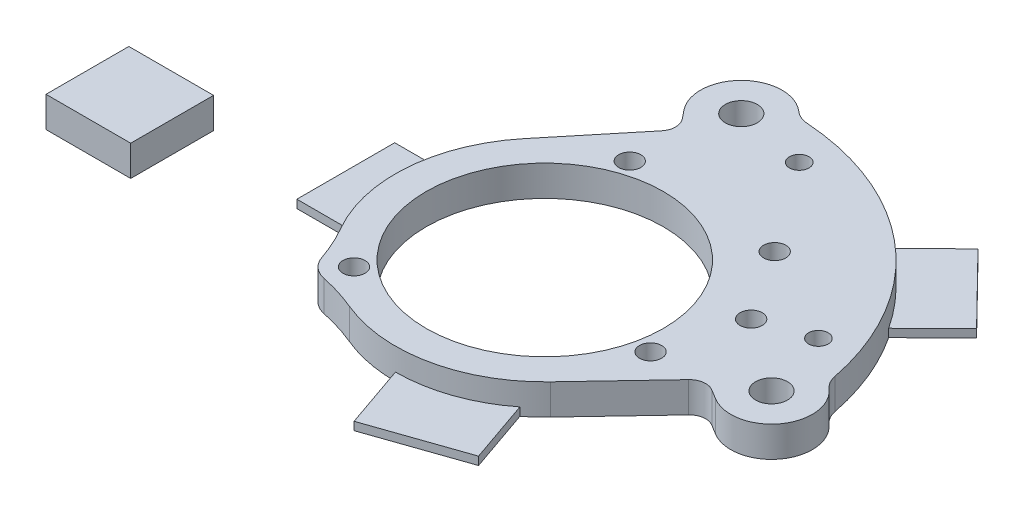
from build123d import *

# Parameters (mm, degrees)
SKETCH1_R                 = 0.127
SKETCH1_R_2               = 18.480949957
BOSS_EXTRUDE1_DEPTH       = 4.7625
FILLET1_R                 = 2.54
F_10_CLEARANCE_HOLE1_D    = 4.9784
CUT_EXTRUDE1_REACH        = 60.938
SKETCH4_R                 = 1.524
F_8_32_TAPPED_HOLE1_D     = 3.4544
F_8_32_TAPPED_HOLE1_DEPTH = 10.7188
F_8_32_TAPPED_HOLE1_TIP   = 1.037806461
BOSS_EXTRUDE2_START       = -4.7625
BOSS_EXTRUDE2_DEPTH       = 4.7625
FILLET2_R                 = 31.75
SKETCH7_W                 = 13.194755421
SKETCH7_H                 = 12.906169147
BOSS_EXTRUDE3_DEPTH       = 4.7625
SKETCH8_W                 = 9.01972476
SKETCH8_H                 = 15.24
BOSS_EXTRUDE4_DEPTH       = 1.27


with BuildPart() as part:
    # Sketch1 → Boss-Extrude1 (new body)
    with BuildSketch(Plane(origin=(0, 0, 0), x_dir=(1, 0, 0), z_dir=(0, 1, 0))):
        with BuildLine():
            Line((32.022269256, -5.421481005), (28.769380653, -3.437844007))
            Line((28.769380653, -3.437844007), (16.899441567, -15.986018234))
            ThreePointArc((16.899441567, -15.986018234), (-15.382244428, -17.450801146), (-17.980601649, 14.759467084))
            Line((-17.980601649, 14.759467084), (-7.021401387, 28.11042435))
            Line((-7.021401387, 28.11042435), (-9.397611693, 31.088632634))
            ThreePointArc((-9.397611693, 31.088632634), (-8.812620694, 39.64785023), (-0.235016559, 39.812554878))
            ThreePointArc((-0.235016559, 39.812554878), (0.816557871, 39.154771525), (2.023694251, 38.869623355))
            ThreePointArc((2.023694251, 38.869623355), (25.590169938, 29.031456949), (38.308287357, 6.886078562))
            ThreePointArc((38.308287357, 6.886078562), (38.742684134, 5.724275154), (39.527245579, 4.763571735))
            ThreePointArc((39.527245579, 4.763571735), (40.440387397, -3.766879153), (32.022269256, -5.421481005))
        make_face()
        with Locations(Location((16.782521583, 19.039383247, 0), (0, 0, 270))):
            Circle(SKETCH1_R, mode=Mode.SUBTRACT)
        with Locations(Location((24.05378148, 8.097328768, 0), (0, 0, 270))):
            Circle(SKETCH1_R, mode=Mode.SUBTRACT)
        with Locations(Location((0, 0, 0), (0, 0, 90))):
            Circle(SKETCH1_R_2, mode=Mode.SUBTRACT)
    extrude(amount=BOSS_EXTRUDE1_DEPTH)

    # Fillet1
    fillet1_edges = [part.edges().sort_by_distance(p)[0] for p in [
        (-7.021401387, 2.38125, -28.11042435),
        (28.769380653, 2.38125, 3.437844007),
    ]]
    fillet(fillet1_edges, radius=FILLET1_R)

    # #10 Clearance Hole1 (through all)
    with Locations(Plane(origin=(0, 4.7625, 0), x_dir=(1, 0, 0), z_dir=(0, 1, 0))):
        with Locations((-4.433931219, 35.048983143), (35.328330918, 0)):
            Hole(F_10_CLEARANCE_HOLE1_D / 2)

    # Sketch4 → Cut-Extrude1 (cut, up to next)
    with BuildSketch(Plane(origin=(0, 4.7625, 0), x_dir=(1, 0, 0), z_dir=(0, 1, 0)), mode=Mode.PRIVATE) as cut_extrude1_sk1:
        with Locations(Location((6.649278755, 32.991606767, 0), (0, 0, 270))):
            Circle(SKETCH4_R)
    cut_extrude1_tool1 = extrude(cut_extrude1_sk1.sketch, amount=-CUT_EXTRUDE1_REACH, mode=Mode.PRIVATE) & part.part
    # Sketch4 → Cut-Extrude1 (cut, up to next)
    with BuildSketch(Plane(origin=(0, 4.7625, 0), x_dir=(1, 0, 0), z_dir=(0, 1, 0)), mode=Mode.PRIVATE) as cut_extrude1_sk2:
        with Locations(Location((31.896208949, 10.737359065, 0), (0, 0, 270))):
            Circle(SKETCH4_R)
    cut_extrude1_tool2 = extrude(cut_extrude1_sk2.sketch, amount=-CUT_EXTRUDE1_REACH, mode=Mode.PRIVATE) & part.part
    add(cut_extrude1_tool1.solids().sort_by_distance((6.649279, 4.7625, -32.991607))[0], mode=Mode.SUBTRACT)
    add(cut_extrude1_tool2.solids().sort_by_distance((31.896209, 4.7625, -10.737359))[0], mode=Mode.SUBTRACT)

    # #8-32 Tapped Hole1
    with Locations(Plane(origin=(-13.924641841, 4.7625, 15.797184665), x_dir=(0, 0, 1), z_dir=(0, 1, 0))):
        with Locations((0, 0), (-11.636683425, 34.56772599), (-35.754870571, 7.206199533), (-34.836567912, 30.707163424), (-23.894513433, 37.978423321)):
            Hole(F_8_32_TAPPED_HOLE1_D / 2, depth=F_8_32_TAPPED_HOLE1_DEPTH)
            with Locations((0, 0, -(F_8_32_TAPPED_HOLE1_DEPTH + F_8_32_TAPPED_HOLE1_TIP / 2))):  # 118° drill point
                Cone(0, F_8_32_TAPPED_HOLE1_D / 2, F_8_32_TAPPED_HOLE1_TIP, mode=Mode.SUBTRACT)

    # Sketch6 → Boss-Extrude2 (add)
    with BuildSketch(Plane(origin=(0, 4.7625, 0), x_dir=(1, 0, 0), z_dir=(0, 1, 0)).offset(BOSS_EXTRUDE2_START)):
        with BuildLine():
            ThreePointArc((-17.800942693, -14.975658365), (-16.544764589, -18.769653428), (-12.623110984, -19.539728077))
            ThreePointArc((-12.623110984, -19.539728077), (-15.382244428, -17.450801146), (-17.800942693, -14.975658365))
        make_face()
    extrude(amount=BOSS_EXTRUDE2_DEPTH)

    # Fillet2
    fillet2_edges = [part.edges().sort_by_distance(p)[0] for p in [
        (-17.800942693, 2.38125, 14.975658365),
        (-12.623110984, 2.38125, 19.539728077),
    ]]
    fillet(fillet2_edges, radius=FILLET2_R)

    # Sketch8 → Boss-Extrude4 (add)
    with BuildSketch(Plane.XZ):
        Polygon((0, 23.262499957), (14.399184208, 18.270396777), (17.818505689, 28.133061492), (3.419321482, 33.125164672), align=None)
        with Locations((-26.488932066, 0)):
            Rectangle(SKETCH8_W, SKETCH8_H)
        Polygon((32.507450275, -21.068755629), (21.842927659, -31.955699984), (28.760500103, -38.731945492), (39.425022719, -27.845001137), align=None)
    extrude(amount=-BOSS_EXTRUDE4_DEPTH)


with BuildPart() as body_2:
    # Sketch7 → Boss-Extrude3 (new body)
    with BuildSketch(Plane(origin=(0, 4.7625, 0), x_dir=(1, 0, 0), z_dir=(0, 1, 0))):
        with Locations((-54.605402604, -10.046163605)):
            Rectangle(SKETCH7_W, SKETCH7_H)
    extrude(amount=-BOSS_EXTRUDE3_DEPTH)


solid = Compound([part.part, body_2.part])
